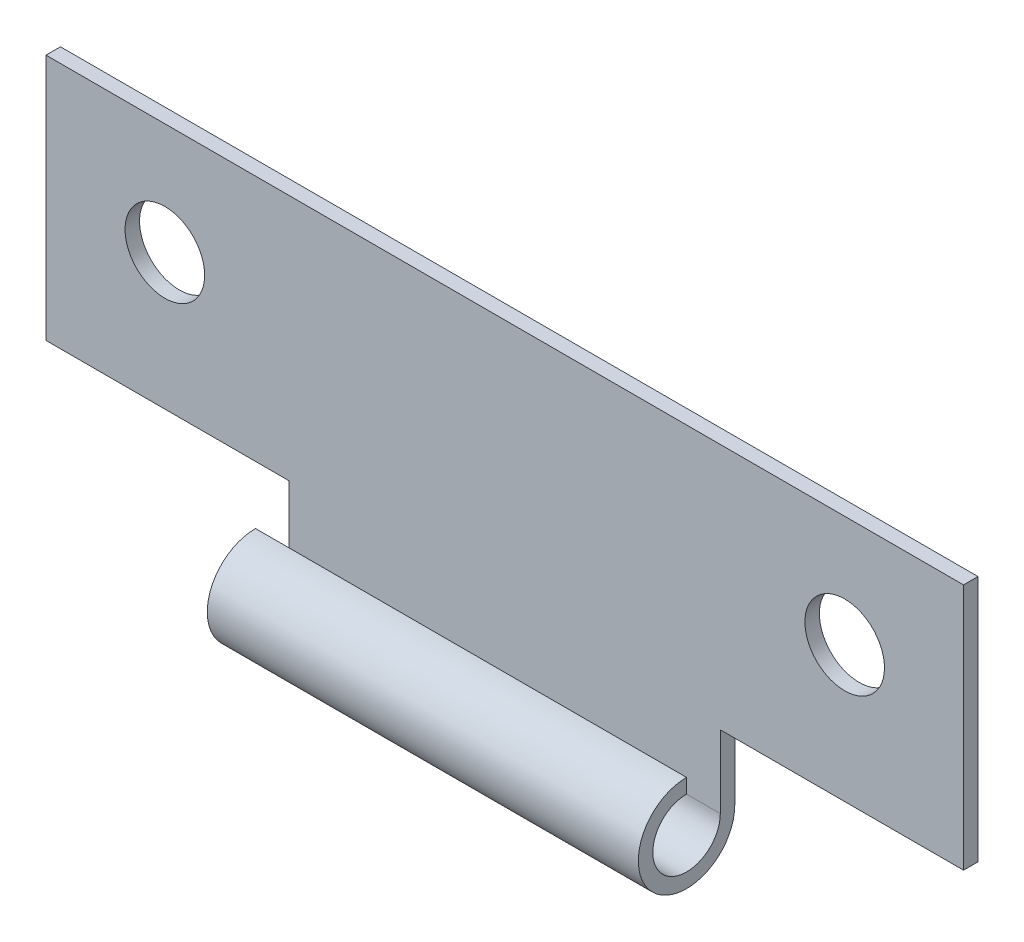
from build123d import *
from build123d.topology import SkipClean

# Parameters (mm, degrees)
SKETCH1_W           = 38.06
SKETCH1_H           = 10.25
BOSS_EXTRUDE1_DEPTH = 0.6
SKETCH2_R           = 1.65
CUT_EXTRUDE1_DEPTH  = 0.6
SKETCH3_W           = 17.88
SKETCH3_H           = 0.6
BOSS_EXTRUDE2_DEPTH = 5.01
BOSS_EXTRUDE3_DEPTH = 17.88
CUT_EXTRUDE2_DEPTH  = 17.88


with BuildPart() as part:
    # Sketch1 → Boss-Extrude1 (new body)
    with BuildSketch(Plane.XY):
        with Locations((19.03, -5.125)):
            Rectangle(SKETCH1_W, SKETCH1_H)
    extrude(amount=BOSS_EXTRUDE1_DEPTH)

    # Sketch2 → Cut-Extrude1 (cut)
    with BuildSketch(Plane.XY.offset(0.6)):
        with Locations((4.93, -4.62)):
            Circle(SKETCH2_R)
        with Locations((33.13, -4.62)):
            Circle(SKETCH2_R)
    extrude(amount=-CUT_EXTRUDE1_DEPTH, mode=Mode.SUBTRACT)

    # Sketch3 → Boss-Extrude2 (add)
    with BuildSketch(Plane.XZ.offset(10.25)):
        with Locations((19.03, 0.3)):
            Rectangle(SKETCH3_W, SKETCH3_H)
    extrude(amount=BOSS_EXTRUDE2_DEPTH)

    # Sketch4 → Boss-Extrude3 (add)
    with BuildSketch(Plane(origin=(27.97, 0, 0), x_dir=(0, 0, -1), z_dir=(1, 0, 0))):
        with BuildLine():
            Line((-2, -11.86), (-2, -11.26))
            ThreePointArc((-2, -11.26), (-3.414213562, -14.674213562), (0, -13.26))
            Line((0, -13.26), (-0.6, -13.26))
            ThreePointArc((-0.6, -13.26), (-2.989949494, -14.249949494), (-2, -11.86))
        make_face()
    extrude(amount=-BOSS_EXTRUDE3_DEPTH)

    # Sketch5 → Cut-Extrude2 (cut)
    with SkipClean():  # the faces are left unmerged after this step: merging them gives an invalid solid
        with BuildSketch(Plane(origin=(27.97, 0, 0), x_dir=(0, 0, -1), z_dir=(1, 0, 0))):
            with BuildLine():
                ThreePointArc((0, -13.26), (-0.156091109, -14.034596669), (-0.6, -14.688285686))
                Line((-0.6, -14.688285686), (-0.6, -15.26))
                Line((-0.6, -15.26), (0, -15.26))
                Line((0, -15.26), (0, -13.26))
            make_face()
        extrude(amount=-CUT_EXTRUDE2_DEPTH, mode=Mode.SUBTRACT)


solid = part.part
